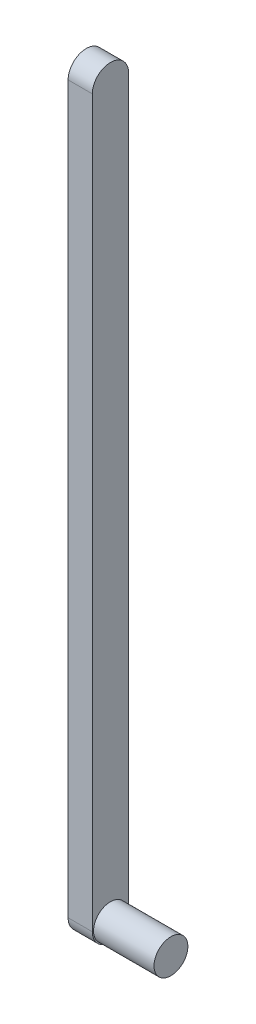
from build123d import *

# Parameters (mm, degrees)
BOSS_EXTRUDE1_DEPTH = 2
SKETCH3_R           = 1.4
BOSS_EXTRUDE3_DEPTH = 5


with BuildPart() as part:
    # Sketch1 → Boss-Extrude1 (new body)
    with BuildSketch(Plane(origin=(0, 0, 0), x_dir=(0, 0, -1), z_dir=(1, 0, 0))):
        with BuildLine():
            Line((-1.5, 0), (-1.5, 60))
            ThreePointArc((-1.5, 60), (0, 61.5), (1.5, 60))
            Line((1.5, 60), (1.5, 0))
            ThreePointArc((1.5, 0), (0, -1.5), (-1.5, 0))
        make_face()
    extrude(amount=BOSS_EXTRUDE1_DEPTH)

    # Sketch3 → Boss-Extrude3 (add)
    with BuildSketch(Plane(origin=(2, 0, 0), x_dir=(0, 0, -1), z_dir=(1, 0, 0))):
        Circle(SKETCH3_R)
    extrude(amount=BOSS_EXTRUDE3_DEPTH)


solid = part.part
